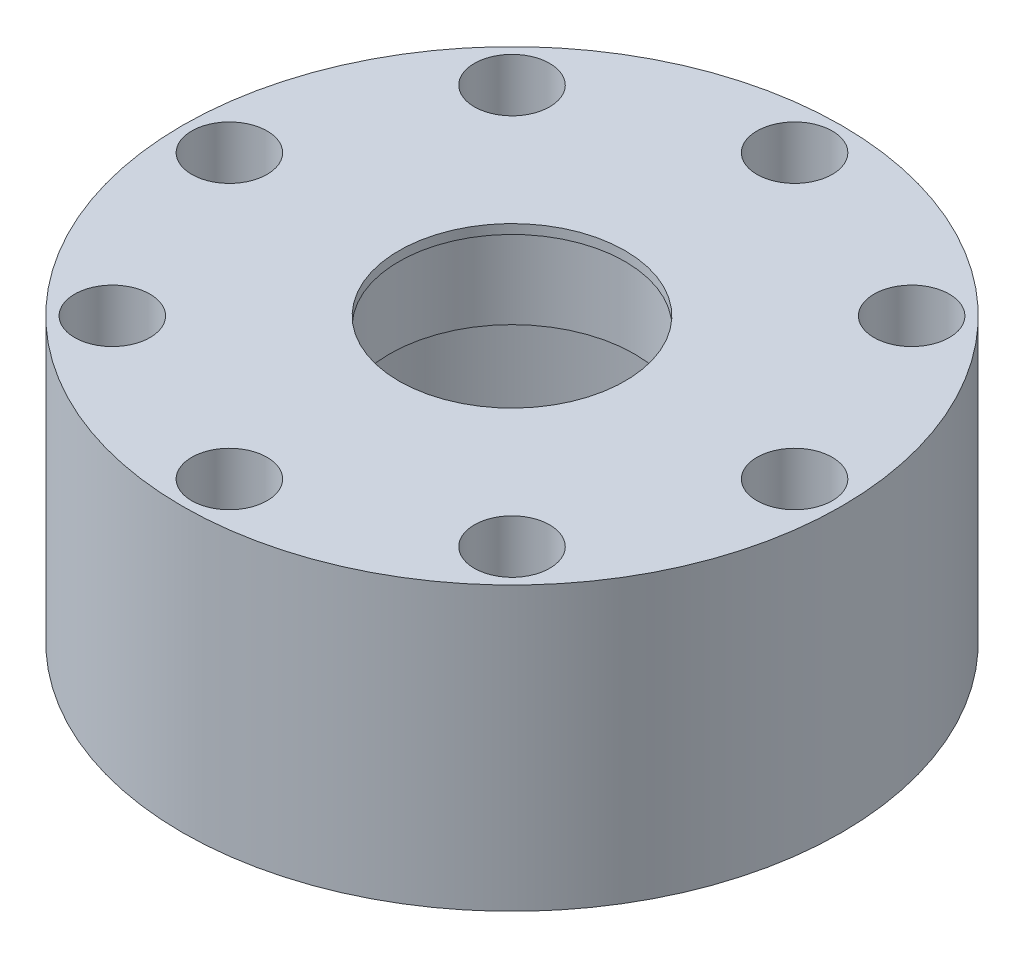
from build123d import *

# Parameters (mm, degrees)
SKETCH2_R          = 2
CUT_EXTRUDE1_DEPTH = 29.939592257


with BuildPart() as part:
    # Sketch1 → Revolve1 (revolve)
    with BuildSketch(Plane.XY, mode=Mode.PRIVATE) as revolve1_sk:
        Polygon((12.5, 0), (17.5, 0), (17.5, 15), (6, 15), (6, 14.5), (6.5, 14.5), (6.5, 10), (7.5, 10), (7.5, 12), (10, 12), (10, 10), (12.5, 10), align=None)
    revolve(revolve1_sk.sketch.rotate(Axis((0, 0, 0), (0, 1, 0)), 90), axis=Axis((0, 0, 0), (0, 1, 0)))

    # Sketch2 → Cut-Extrude1 (cut, through all)
    with BuildSketch(Plane(origin=(0, 15, 0), x_dir=(1, 0, 0), z_dir=(0, 1, 0))):
        with Locations(Location((15, 0, 0), (0, 0, 270))):
            Circle(SKETCH2_R)
        with Locations(Location((10.606601718, -10.606601718, 0), (0, 0, 270))):
            Circle(SKETCH2_R)
        with Locations(Location((0, -15, 0), (0, 0, 270))):
            Circle(SKETCH2_R)
        with Locations(Location((-10.606601718, -10.606601718, 0), (0, 0, 270))):
            Circle(SKETCH2_R)
        with Locations(Location((-15, 0, 0), (0, 0, 270))):
            Circle(SKETCH2_R)
        with Locations(Location((-10.606601718, 10.606601718, 0), (0, 0, 270))):
            Circle(SKETCH2_R)
        with Locations(Location((0, 15, 0), (0, 0, 270))):
            Circle(SKETCH2_R)
        with Locations(Location((10.606601718, 10.606601718, 0), (0, 0, 270))):
            Circle(SKETCH2_R)
    extrude(amount=-CUT_EXTRUDE1_DEPTH, mode=Mode.SUBTRACT)


solid = part.part
